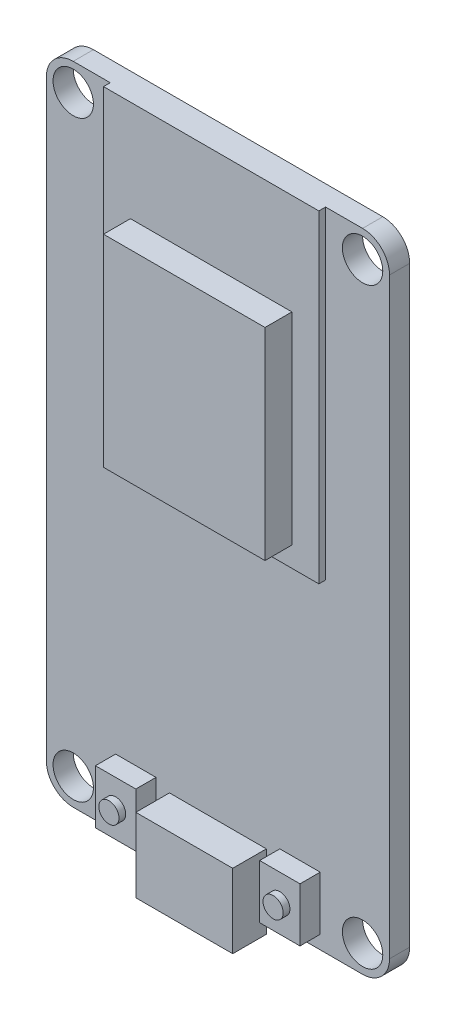
from build123d import *

# Parameters (mm, degrees)
SKETCH1_W              = 25.5
SKETCH1_H              = 48
PCB_DEPTH              = 1.5
FILLET1_R              = 2
SCREW_HOLES_DEPTH      = 28.217870967
SCREW_HOLES_DEPTH_BACK = 28.217870967
SKETCH2_R              = 1.5
SKETCH3_W              = 16
SKETCH3_H              = 24
ESP_PCB_DEPTH          = 0.5
SKETCH4_W              = 12
SKETCH4_H              = 15
RF_CASING_DEPTH        = 2
SKETCH5_W              = 7.2
SKETCH5_H              = 5.5
USB_PORT_DEPTH         = 2.5
SKETCH6_W              = 3
SKETCH6_H              = 4
BUTTON_BOTTOM_DEPTH    = 1.5
SKETCH7_R              = 0.75
BUTTON_TOP_DEPTH       = 0.5


with BuildPart() as part:
    # Sketch1 → PCB (new body)
    with BuildSketch(Plane.XY):
        Rectangle(SKETCH1_W, SKETCH1_H)
    extrude(amount=PCB_DEPTH)

    # Fillet1
    fillet1_edges = [part.edges().sort_by_distance(p)[0] for p in [
        (12.75, -24, 0.75),
        (-12.75, -24, 0.75),
        (-12.75, 24, 0.75),
        (12.75, 24, 0.75),
    ]]
    fillet(fillet1_edges, radius=FILLET1_R)

    # Sketch2 → Screw holes (cut, two sides: drawn at the far end of the back side and taken through both)
    with BuildSketch(Plane.XY.offset(1.5).offset(-SCREW_HOLES_DEPTH_BACK)):
        with Locations((-10.75, 22)):
            Circle(SKETCH2_R)
        with Locations((10.75, 22)):
            Circle(SKETCH2_R)
        with Locations((10.75, -22)):
            Circle(SKETCH2_R)
        with Locations((-10.75, -22)):
            Circle(SKETCH2_R)
    extrude(amount=SCREW_HOLES_DEPTH + SCREW_HOLES_DEPTH_BACK, mode=Mode.SUBTRACT)

    # Sketch3 → ESP PCB (add)
    with BuildSketch(Plane.XY.offset(1.5)):
        with Locations((0, 12)):
            Rectangle(SKETCH3_W, SKETCH3_H)
    extrude(amount=ESP_PCB_DEPTH)

    # Sketch4 → RF Casing (add)
    with BuildSketch(Plane.XY.offset(2)):
        with Locations((0, 9)):
            Rectangle(SKETCH4_W, SKETCH4_H)
    extrude(amount=RF_CASING_DEPTH)

    # Sketch5 → USB Port (add)
    with BuildSketch(Plane.XY.offset(1.5)):
        with Locations((0, -22.25)):
            Rectangle(SKETCH5_W, SKETCH5_H)
    extrude(amount=USB_PORT_DEPTH)

    # Sketch6 → Button Bottom (add)
    with BuildSketch(Plane.XY.offset(1.5)):
        with Locations((-6.1, -21)):
            Rectangle(SKETCH6_W, SKETCH6_H)
        with Locations((6.1, -21)):
            Rectangle(SKETCH6_W, SKETCH6_H)
    extrude(amount=BUTTON_BOTTOM_DEPTH)

    # Sketch7 → Button Top (add)
    with BuildSketch(Plane.XY.offset(3)):
        with Locations((-6.1, -21)):
            Circle(SKETCH7_R)
        with Locations((6.1, -21)):
            Circle(SKETCH7_R)
    extrude(amount=BUTTON_TOP_DEPTH)


solid = part.part
